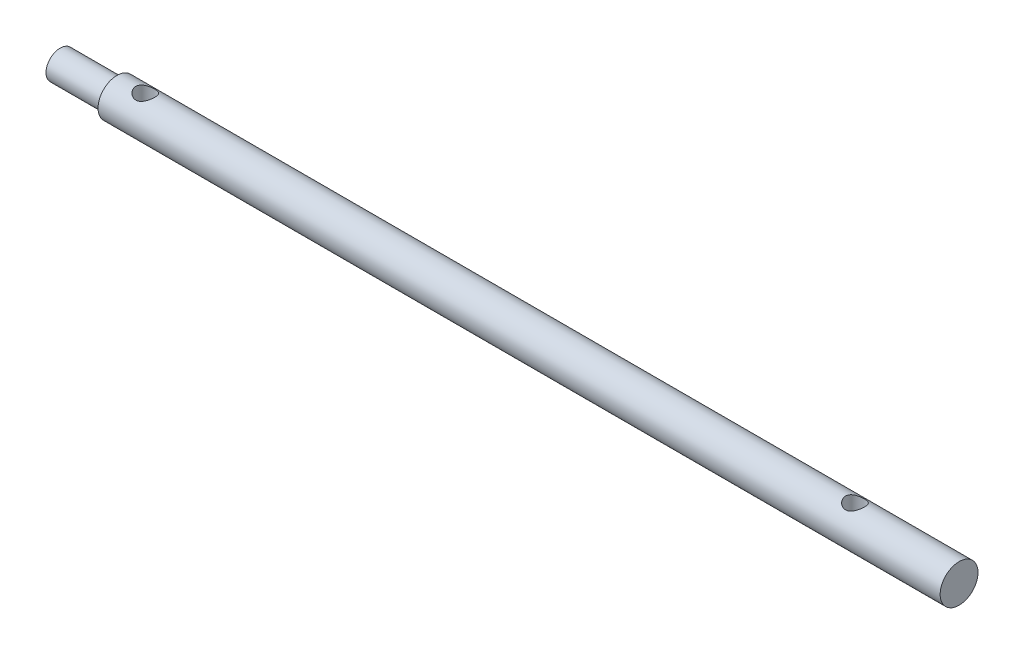
from build123d import *

# Parameters (mm, degrees)
CUT_EXTRUDE1_DEPTH      = 90.044932478
CUT_EXTRUDE1_DEPTH_BACK = 90.044932478
SKETCH3_R               = 1


with BuildPart() as part:
    # Sketch1 → Revolve1 (revolve)
    with BuildSketch(Plane.XY, mode=Mode.PRIVATE) as revolve1_sk:
        Polygon((0, 1.5), (-6, 1.5), (-6, 0), (89, 0), (89, 2), (0, 2), align=None)
    revolve(revolve1_sk.sketch.rotate(Axis((-6, 0, 0), (1, 0, 0)), 180), axis=Axis((-6, 0, 0), (1, 0, 0)))

    # Sketch3 → Cut-Extrude1 (cut, two sides: drawn at the far end of the back side and taken through both)
    with BuildSketch(Plane(origin=(0, 0, 0), x_dir=(1, 0, 0), z_dir=(0, 1, 0)).offset(-CUT_EXTRUDE1_DEPTH_BACK)):
        with Locations(Location((3, 0, 0), (0, 0, 270))):
            Circle(SKETCH3_R)
        with Locations(Location((78, 0, 0), (0, 0, 270))):
            Circle(SKETCH3_R)
    extrude(amount=CUT_EXTRUDE1_DEPTH + CUT_EXTRUDE1_DEPTH_BACK, mode=Mode.SUBTRACT)


solid = part.part
